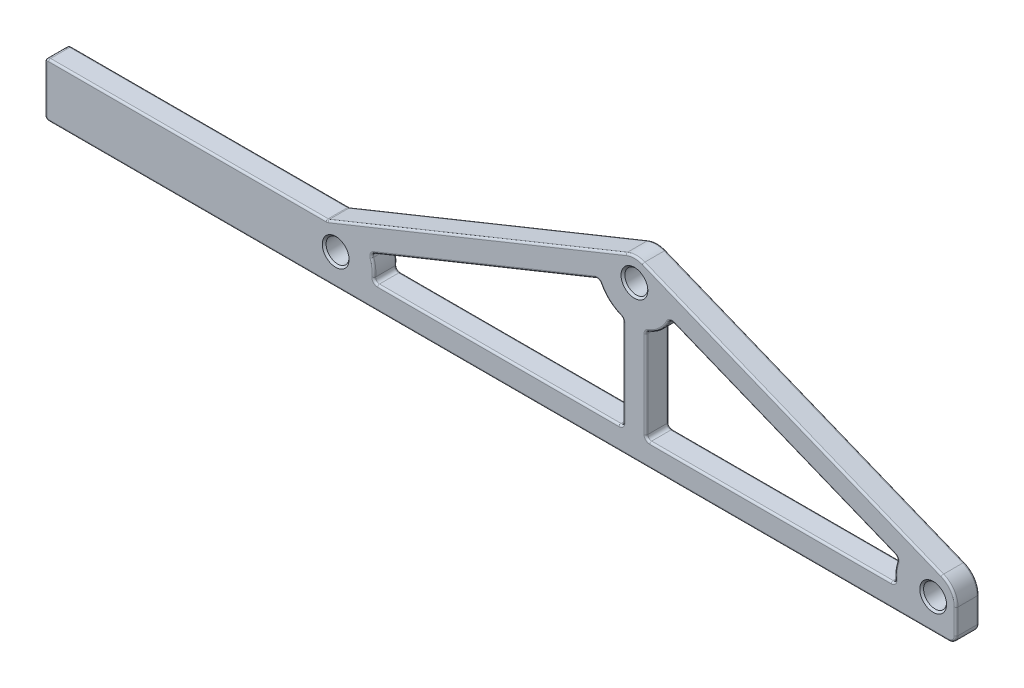
from build123d import *

# Parameters (mm, degrees)
ESBO_O1_R                = 3
ESBO_O1_R_2              = 3.0000000000000084
RESSALTO_EXTRUS_O1_DEPTH = 3
CHANFRO1_SIZE            = 0.5
CORTE_EXTRUS_O1_DEPTH    = 7
FILETE2_R                = 1
FILETE1_R                = 0.5


with BuildPart() as part:
    # Esboço1 → Ressalto-extrusão1 (new, symmetric)
    with BuildSketch(Plane.XY):
        with BuildLine():
            Line((-2.2495699654391412, 5.562322803523193), (-80.24956996543914, -25.983213746982642))
            Line((-80.24956996543914, -25.983213746982642), (-153.9280580647533, -25.983213746982642))
            Line((-153.9280580647533, -25.983213746982642), (-153.9280580647533, -40.04420200000002))
            Line((-153.9280580647533, -40.04420200000002), (-81.99999999999999, -40.044202))
            Line((-81.99999999999999, -40.044202), (81.99999999999999, -40.044202))
            ThreePointArc((81.99999999999999, -40.044202), (83.41421356237308, -39.45841556237309), (84, -38.044202))
            Line((84, -38.044202), (84, -31.54553655050584))
            ThreePointArc((84, -31.54553655050584), (82.97480752354474, -28.191242272467225), (80.24956996543914, -25.983213746982642))
            Line((80.24956996543914, -25.983213746982642), (2.249569965439149, 5.562322803523193))
            ThreePointArc((2.249569965439149, 5.562322803523193), (3.03e-15, 6.000000000000001), (-2.2495699654391412, 5.562322803523193))
        make_face()
        Circle(ESBO_O1_R, mode=Mode.SUBTRACT)
        with Locations((-78, -32)):
            Circle(ESBO_O1_R_2, mode=Mode.SUBTRACT)
        with Locations((78, -32)):
            Circle(ESBO_O1_R_2, mode=Mode.SUBTRACT)
    extrude(amount=RESSALTO_EXTRUS_O1_DEPTH, both=True)

    # Chanfro1
    chanfro1_edges = [part.edges().sort_by_distance(p)[0] for p in [
        (-3, 3.7e-16, -3),
        (-3, 3.7e-16, 3),
        (-81.00000000000001, -32, -3),
        (-81.00000000000001, -32, 3),
        (74.99999999999999, -32, -3),
        (74.99999999999999, -32, 3),
    ]]
    chamfer(chanfro1_edges, length=CHANFRO1_SIZE)

    # Esboço2 → Corte-extrusão1 (cut, symmetric)
    with BuildSketch(Plane.XY):
        with BuildLine():
            ThreePointArc((-68, -32), (-68.05293200995904, -33.027539975622474), (-68.21116768030045, -34.044202000000354))
            Line((-68.21116768030052, -34.044202000000006), (-2.999999999999986, -34.044202000000006))
            Line((-2.9999999999999907, -34.044202), (-2.9999999999999907, -9.539392014169486))
            ThreePointArc((-2.999999999999943, -9.539392014169474), (-6.784015443608515, -7.346913260742988), (-9.270538005871929, -3.74928327573206))
            Line((-9.270538005871986, -3.7492832757319046), (-68.89565525894349, -27.863466809513486))
            ThreePointArc((-68.89565525894358, -27.863466809513305), (-68.22647843890023, -29.883806177421874), (-68, -32))
        make_face()
        with BuildLine():
            Line((3.0000000000000098, -9.53939201416961), (3.0000000000000098, -34.044202))
            Line((3.000000000000014, -34.044202), (68.21116768030028, -34.044202))
            ThreePointArc((68.21116768030033, -34.04420199999977), (68.06076427807452, -30.89927602733458), (68.89565525894358, -27.863466809513298))
            Line((68.89565525894348, -27.863466809513472), (9.270538005871988, -3.7492832757319006))
            ThreePointArc((9.27053800587193, -3.749283275732055), (6.784015443608441, -7.346913260743056), (2.999999999999736, -9.53939201416954))
        make_face()
    extrude(amount=CORTE_EXTRUS_O1_DEPTH, both=True, mode=Mode.SUBTRACT)

    # Filete2
    filete2_edges = [part.edges().sort_by_distance(p)[0] for p in [
        (-153.9280580647533, -40.04420200000002, 0),
        (-153.9280580647533, -25.983213746982642, 0),
        (-80.24956996543914, -25.983213746982642, 0),
        (-9.270538005871957, -3.749283275731983, 0),
        (-2.999999999999967, -9.53939201416948, 0),
        (-2.9999999999999885, -34.044202, 0),
        (-68.21116768030049, -34.04420200000018, 0),
        (-68.89565525894353, -27.863466809513397, 0),
        (2.9999999999998734, -9.539392014169575, 0),
        (9.270538005871959, -3.749283275731978, 0),
        (68.89565525894352, -27.863466809513383, 0),
        (68.2111676803003, -34.044201999999885, 0),
        (3.000000000000012, -34.044202, 0),
    ]]
    fillet(filete2_edges, radius=FILETE2_R)

    # Filete1
    filete1_edges = [part.edges().sort_by_distance(p)[0] for p in [
        (4.33e-15, 6.000000000000002, 3),
        (-35.46402903237666, -40.044202000000006, -3),
        (-35.46402903237666, -40.044202000000006, 3),
        (-153.9280580647533, -33.013707873491335, -3),
        (-116.68609420713314, -25.983213746982642, -3),
        (-2.9999999999999902, -21.645576382979804, -3),
        (-6.697004200554872, -7.426313670843051, -3),
        (-39.06492840230362, -15.79902726612516, -3.0000000000000004),
        (-68.06990265748041, -30.819675142985826, -3),
        (-41.15938599368947, -10.173972372023329, -3),
        (-35.52483693888492, -34.044202000000006, -3),
        (39.06492840230361, -15.799027266125155, -3),
        (6.69700420055487, -7.426313670843051, -3),
        (3.0000000000000084, -21.645576382979797, -3),
        (35.52483693888493, -34.044202, -3),
        (68.06990265748041, -30.819675142985833, -3),
        (-153.63516484593984, -26.276106965796096, -3),
        (4.33e-15, 6.000000000000002, -3),
        (-153.63516484593984, -39.75130878118657, -3),
        (-153.9280580647533, -33.013707873491335, 3),
        (-6.697004200554872, -7.426313670843051, 3),
        (-2.9999999999999902, -21.645576382979804, 3),
        (-35.52483693888492, -34.044202000000006, 3),
        (41.24956996543914, -10.210445471729724, -3),
        (-68.06990265748041, -30.819675142985826, 3),
        (-39.06492840230362, -15.79902726612516, 3.0000000000000004),
        (-116.68609420713314, -25.983213746982642, 3),
        (6.69700420055487, -7.426313670843051, 3),
        (39.06492840230361, -15.799027266125155, 3),
        (68.06990265748041, -30.819675142985833, 3),
        (82.97480752354474, -28.19124227246723, -3),
        (35.52483693888493, -34.044202, 3),
        (3.0000000000000084, -21.645576382979797, 3),
        (-41.15938599368947, -10.173972372023329, 3),
        (-153.63516484593984, -26.276106965796096, 3),
        (-153.63516484593984, -39.75130878118657, 3),
        (-80.25315103202966, -25.964807807831434, -3),
        (-80.25315103202966, -25.964807807831434, 3),
        (3.2928932188134614, -33.751308781186545, 3),
        (3.2928932188134614, -33.751308781186545, -3),
        (-3.2928932188134405, -33.75130878118655, 3),
        (-3.2928932188134405, -33.75130878118655, -3),
        (67.78958179587369, -33.716910163119245, 3),
        (67.78958179587369, -33.716910163119245, -3),
        (68.50961158101003, -28.00347288767457, 3),
        (68.50961158101003, -28.00347288767457, -3),
        (-9.432320620733224, -4.096736615700223, 3),
        (-9.432320620733224, -4.096736615700223, -3),
        (-3.17427717615522, -9.682874691141835, 3),
        (-3.17427717615522, -9.682874691141835, -3),
        (9.432320620733222, -4.096736615700219, 3),
        (9.432320620733222, -4.096736615700219, -3),
        (3.1742771761552384, -9.682874691141828, 3),
        (3.1742771761552384, -9.682874691141828, -3),
        (-68.50961158101003, -28.003472887674565, 3),
        (-68.50961158101003, -28.003472887674565, -3),
        (-67.78958179587367, -33.71691016311925, 3),
        (-67.78958179587367, -33.71691016311925, -3),
        (83.41421356237308, -39.45841556237309, 3),
        (84, -34.79486927525292, 3),
        (82.97480752354474, -28.19124227246723, 3),
        (41.24956996543914, -10.210445471729724, 3),
        (84, -34.79486927525292, -3),
        (83.41421356237308, -39.45841556237309, -3),
    ]]
    fillet(filete1_edges, radius=FILETE1_R)


solid = part.part
